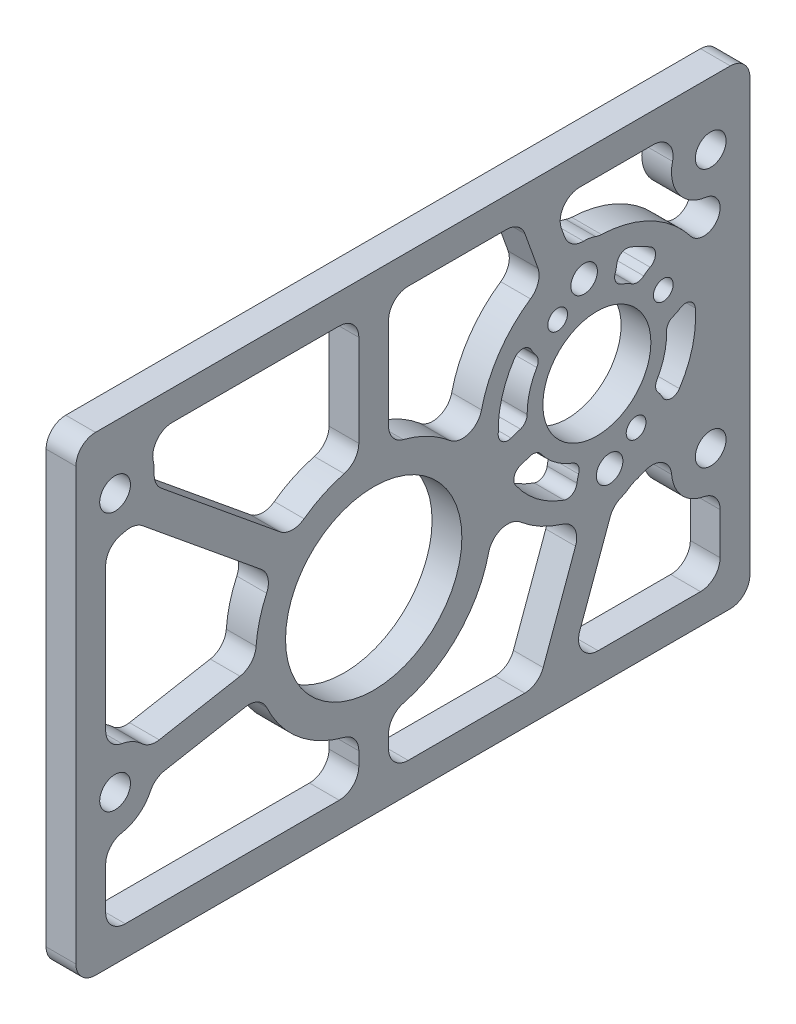
from build123d import *

# Parameters (mm, degrees)
SKETCH2_W            = 109.22
SKETCH2_H            = 76.2
SKETCH2_R            = 14.2875
SKETCH2_R_2          = 8.75
SKETCH2_R_3          = 2.4892
BOSS_EXTRUDE1_DEPTH  = 4.826
M3_CLEARANCE_HOLE1_D = 3.2
M4_CLEARANCE_HOLE2_D = 4.3
CUT_EXTRUDE1_DEPTH   = 76.599036872
FILLET1_R            = 3.175
FILLET3_R            = 1.5875
FILLET4_R            = 3.175


with BuildPart() as part:
    # Sketch2 → Boss-Extrude1 (new body)
    with BuildSketch(Plane(origin=(0, 0, 0), x_dir=(0, 0, -1), z_dir=(1, 0, 0))):
        with Locations((6.35, 6.35)):
            Rectangle(SKETCH2_W, SKETCH2_H)
        Circle(SKETCH2_R, mode=Mode.SUBTRACT)
        with Locations((36.165607136, 12.066274722)):
            Circle(SKETCH2_R_2, mode=Mode.SUBTRACT)
        with Locations((54.61, 34.29)):
            Circle(SKETCH2_R_3, mode=Mode.SUBTRACT)
        with Locations((54.61, -7.62)):
            Circle(SKETCH2_R_3, mode=Mode.SUBTRACT)
        with Locations((-41.91, 34.29)):
            Circle(SKETCH2_R_3, mode=Mode.SUBTRACT)
        with Locations((-41.91, -7.62)):
            Circle(SKETCH2_R_3, mode=Mode.SUBTRACT)
    extrude(amount=-BOSS_EXTRUDE1_DEPTH)

    # M3 Clearance Hole1 (through all)
    with Locations(Plane(origin=(0, 0, 0), x_dir=(0, 0, -1), z_dir=(1, 0, 0))):
        with Locations((42.521092502, 1.302548334), (29.81012177, 22.83000111), (46.929333524, 18.421760088)):
            Hole(M3_CLEARANCE_HOLE1_D / 2)

    # M4 Clearance Hole2 (through all)
    with Locations(Plane(origin=(0, 0, 0), x_dir=(0, 0, -1), z_dir=(1, 0, 0))):
        with Locations((34.101503997, 26.418608269), (38.229710274, -2.286058825)):
            Hole(M4_CLEARANCE_HOLE2_D / 2)

    # Sketch7 → Cut-Extrude1 (cut, through all)
    with BuildSketch(Plane(origin=(0, 0, 0), x_dir=(0, 0, -1), z_dir=(1, 0, 0))):
        with BuildLine():
            Line((2.413, 39.624), (2.413, 18.960572598))
            ThreePointArc((2.413, 18.960572598), (7.684686035, 17.500613783), (12.326954979, 14.607260633))
            ThreePointArc((12.326954979, 14.607260633), (15.382001612, 14.022767149), (17.470209473, 16.328050319))
            ThreePointArc((17.470209473, 16.328050319), (21.051753907, 23.866785965), (27.496737095, 29.169821641))
            Line((27.496737095, 29.169821641), (23.764159759, 39.624))
            Line((23.764159759, 39.624), (2.413, 39.624))
        make_face()
        with BuildLine():
            Line((-35.83603194, 32.438132831), (-13.146670772, 13.874110057))
            ThreePointArc((-13.146670772, 13.874110057), (-8.184977943, 17.272290477), (-2.413, 18.960572598))
            Line((-2.413, 18.960572598), (-2.413, 39.624))
            Line((-2.413, 39.624), (-38.464576369, 39.624))
            ThreePointArc((-38.464576369, 39.624), (-35.946454387, 36.471426991), (-35.83603194, 32.438132831))
        make_face()
        with BuildLine():
            Line((-36.562729105, -4.195208915), (-19.08638742, -1.017692245))
            ThreePointArc((-19.08638742, -1.017692245), (-18.505334554, 4.783144916), (-16.202676347, 10.138992131))
            Line((-16.202676347, 10.138992131), (-38.892037516, 28.703014906))
            ThreePointArc((-38.892037516, 28.703014906), (-41.109165915, 27.990701248), (-43.434, 28.125592161))
            Line((-43.434, 28.125592161), (-43.434, -1.455592161))
            ThreePointArc((-43.434, -1.455592161), (-39.558250636, -1.7215447), (-36.562729105, -4.195208915))
        make_face()
        with BuildLine():
            ThreePointArc((-2.413, -18.960572598), (-12.24692618, -14.674422694), (-18.223086295, -5.765848431))
            Line((-18.223086295, -5.765848431), (-35.69942798, -8.943365101))
            ThreePointArc((-35.69942798, -8.943365101), (-38.541036803, -13.00261897), (-43.434, -13.784407839))
            Line((-43.434, -13.784407839), (-43.434, -26.924))
            Line((-43.434, -26.924), (-2.413, -26.924))
            Line((-2.413, -26.924), (-2.413, -18.960572598))
        make_face()
        with BuildLine():
            ThreePointArc((18.628281266, -4.27937137), (12.828417545, -14.168895001), (2.413, -18.960572598))
            Line((2.413, -18.960572598), (2.413, -26.924))
            Line((2.413, -26.924), (26.706016233, -26.924))
            Line((26.706016233, -26.924), (33.955576471, -6.980940021))
            ThreePointArc((33.955576471, -6.980940021), (28.538735982, -5.526663105), (23.774415905, -2.567214434))
            ThreePointArc((23.774415905, -2.567214434), (20.720354401, -1.977595499), (18.628281266, -4.27937137))
        make_face()
        with BuildLine():
            ThreePointArc((25.101656873, 23.624345693), (20.96930921, 17.073522404), (20.397975513, 9.349329191))
            Line((20.397975513, 9.349329191), (24.93002626, 10.861400291))
            ThreePointArc((24.93002626, 10.861400291), (25.273830284, 15.076124721), (27.142952485, 18.869340432))
            ThreePointArc((27.142952485, 18.869340432), (25.422353128, 20.946358005), (25.101656873, 23.624345693))
        make_face()
        with BuildLine():
            Line((26.457402807, 6.283475338), (21.92535206, 4.771404237))
            ThreePointArc((21.92535206, 4.771404237), (26.536319707, -0.711707263), (33.07786674, -3.632956445))
            ThreePointArc((33.07786674, -3.632956445), (33.012304228, -1.221024012), (34.017931608, 0.972245254))
            ThreePointArc((34.017931608, 0.972245254), (29.670011471, 2.819803127), (26.457402807, 6.283475338))
        make_face()
        with BuildLine():
            Line((51.164576369, 39.624), (28.888541812, 39.624))
            Line((28.888541812, 39.624), (31.876152918, 31.25631822))
            ThreePointArc((31.876152918, 31.25631822), (34.120550731, 31.743574205), (36.361405453, 31.240275035))
            ThreePointArc((36.361405453, 31.240275035), (44.732568433, 29.221093262), (51.375955134, 23.742144658))
            ThreePointArc((51.375955134, 23.742144658), (55.782044462, 24.037241249), (53.813492648, 27.990152697))
            ThreePointArc((53.813492648, 27.990152697), (48.41846583, 32.880246611), (51.164576369, 39.624))
        make_face()
        with BuildLine():
            Line((38.875788031, -7.571719477), (31.840983767, -26.924))
            Line((31.840983767, -26.924), (56.134, -26.924))
            Line((56.134, -26.924), (56.134, -13.784407839))
            ThreePointArc((56.134, -13.784407839), (50.907154803, -12.778627477), (48.28201279, -8.148278217))
            ThreePointArc((48.28201279, -8.148278217), (46.744111184, -5.685431632), (43.84625592, -5.503251716))
            ThreePointArc((43.84625592, -5.503251716), (42.812745787, -5.919724632), (41.756789435, -6.275461987))
            ThreePointArc((41.756789435, -6.275461987), (40.414631448, -7.14216266), (38.875788031, -7.571719477))
        make_face()
        with BuildLine():
            ThreePointArc((47.723678107, 23.130224985), (43.84651886, 26.102071639), (39.253347531, 27.765505889))
            ThreePointArc((39.253347531, 27.765505889), (39.318910043, 25.353573456), (38.313282663, 23.16030419))
            ThreePointArc((38.313282663, 23.16030419), (40.759253899, 22.390441004), (42.968672846, 21.088929373))
            ThreePointArc((42.968672846, 21.088929373), (45.045690419, 22.80952873), (47.723678107, 23.130224985))
        make_face()
        with BuildLine():
            ThreePointArc((47.351871228, 13.66549192), (47.108627227, 9.248418926), (45.188261786, 5.263209012))
            ThreePointArc((45.188261786, 5.263209012), (46.107235317, 4.455357353), (46.790735221, 3.44048567))
            ThreePointArc((46.790735221, 3.44048567), (48.117291131, 2.566488315), (49.536907507, 3.279447855))
            ThreePointArc((49.536907507, 3.279447855), (51.660148841, 8.076390345), (52.117798906, 13.302226875))
            ThreePointArc((52.117798906, 13.302226875), (51.219083395, 14.612162944), (49.635386137, 14.487563314))
            ThreePointArc((49.635386137, 14.487563314), (48.546729483, 13.929026476), (47.351871228, 13.66549192))
        make_face()
    extrude(amount=-CUT_EXTRUDE1_DEPTH, mode=Mode.SUBTRACT)

    # Fillet1
    fillet1_edges = [part.edges().sort_by_distance(p)[0] for p in [
        (-2.413, 31.240275035, -36.361405453),
        (-2.413, 31.25631822, -31.876152918),
        (-2.413, 39.624, -28.888541812),
        (-2.413, 39.624, -51.164576369),
        (-2.413, 18.960572598, -2.413),
        (-2.413, 39.624, -2.413),
        (-2.413, 39.624, -23.764159759),
        (-2.413, 29.169821641, -27.496737095),
        (-2.413, -6.980940021, -33.955576471),
        (-2.413, -26.924, -26.706016233),
        (-2.413, -26.924, -2.413),
        (-2.413, -18.960572598, -2.413),
        (-2.413, -5.765848431, 18.223086295),
        (-2.413, -18.960572598, 2.413),
        (-2.413, -26.924, 2.413),
        (-2.413, -26.924, 43.434),
        (-2.413, -13.784407839, 43.434),
        (-2.413, -8.943365101, 35.69942798),
        (-2.413, 18.960572598, 2.413),
        (-2.413, 13.874110057, 13.146670772),
        (-2.413, 32.438132831, 35.83603194),
        (-2.413, 39.624, 38.464576369),
        (-2.413, 39.624, 2.413),
        (-2.413, -13.784407839, -56.134),
        (-2.413, -26.924, -56.134),
        (-2.413, -26.924, -31.840983767),
        (-2.413, -7.571719477, -38.875788031),
        (-2.413, -6.275461987, -41.756789435),
        (-2.413, 10.138992131, 16.202676347),
        (-2.413, -1.017692245, 19.08638742),
        (-2.413, -4.195208915, 36.562729105),
        (-2.413, -1.455592161, 43.434),
        (-2.413, 28.125592161, 43.434),
        (-2.413, 28.703014906, 38.892037516),
    ]]
    fillet(fillet1_edges, radius=FILLET1_R)

    # Fillet3
    fillet3_edges = [part.edges().sort_by_distance(p)[0] for p in [
        (-2.413, 21.088929373, -42.968672846),
        (-2.413, 23.16030419, -38.313282663),
        (-2.413, 27.765505889, -39.253347531),
        (-2.413, 23.130224985, -47.723678107),
        (-2.413, 18.869340432, -27.142952485),
        (-2.413, 10.861400291, -24.93002626),
        (-2.413, 9.349329191, -20.397975513),
        (-2.413, 23.624345693, -25.101656873),
        (-2.413, 6.283475338, -26.457402807),
        (-2.413, 0.972245254, -34.017931608),
        (-2.413, -3.632956445, -33.07786674),
        (-2.413, 4.771404237, -21.92535206),
        (-2.413, 5.263209012, -45.188261786),
        (-2.413, 13.66549192, -47.351871228),
    ]]
    fillet(fillet3_edges, radius=FILLET3_R)

    # Fillet4
    fillet4_edges = [part.edges().sort_by_distance(p)[0] for p in [
        (-2.413, 44.45, 48.26),
        (-2.413, 44.45, -60.96),
        (-2.413, -31.75, -60.96),
        (-2.413, -31.75, 48.26),
    ]]
    fillet(fillet4_edges, radius=FILLET4_R)


solid = part.part
